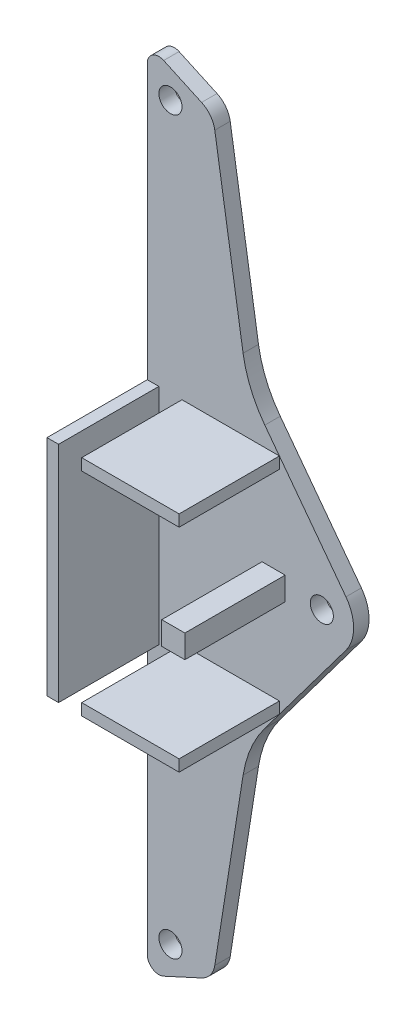
from build123d import *

# Parameters (mm, degrees)
SKETCH1_R           = 1.5
BOSS_EXTRUDE1_DEPTH = 2
FILLET1_R           = 15
FILLET2_R           = 3
FILLET3_R           = 1.5
FILLET4_R           = 5
SKETCH2_W           = 1.5
SKETCH2_H           = 3
SKETCH2_W_2         = 0.75
BOSS_EXTRUDE2_DEPTH = 13
SKETCH4_W           = 3
SKETCH4_H           = 29
CUT_EXTRUDE1_DEPTH  = 13


with BuildPart() as part:
    # Sketch1 → Boss-Extrude1 (new body)
    with BuildSketch(Plane.XY):
        Polygon((0, 52.37615434), (0, -52.37615434), (8.5, -48.47615434), (13, -20), (28, 0), (13, 20), (8.5, 48.47615434), align=None)
        with Locations((3, -47.37615434)):
            Circle(SKETCH1_R, mode=Mode.SUBTRACT)
        with Locations((22.62384566, 0)):
            Circle(SKETCH1_R, mode=Mode.SUBTRACT)
        with Locations(Location((3, 47.37615434, 0), (0, 0, 180))):
            Circle(SKETCH1_R, mode=Mode.SUBTRACT)
    extrude(amount=BOSS_EXTRUDE1_DEPTH)

    # Fillet1
    fillet1_edges = [part.edges().sort_by_distance(p)[0] for p in [
        (13, 20, 1),
        (13, -20, 1),
    ]]
    fillet(fillet1_edges, radius=FILLET1_R)

    # Fillet2
    fillet2_edges = [part.edges().sort_by_distance(p)[0] for p in [
        (8.5, 48.47615434, 1),
        (8.5, -48.47615434, 1),
    ]]
    fillet(fillet2_edges, radius=FILLET2_R)

    # Fillet3
    fillet3_edges = [part.edges().sort_by_distance(p)[0] for p in [
        (0, -52.37615434, 1),
        (0, 52.37615434, 1),
    ]]
    fillet(fillet3_edges, radius=FILLET3_R)

    # Fillet4
    fillet4_edges = [part.edges().sort_by_distance(p)[0] for p in [
        (28, 0, 1),
    ]]
    fillet(fillet4_edges, radius=FILLET4_R)

    # Sketch2 → Boss-Extrude2 (add)
    with BuildSketch(Plane.XY.offset(2)):
        Polygon((17.125, 13), (17.125, 14.5), (0, 14.5), (0, -14.5), (17.125, -14.5), (17.125, -13), (15.625, -13), (1.5, -13), (1.5, 13), (15.625, 13), align=None)
        with Locations((16.375, 0)):
            Rectangle(SKETCH2_W, SKETCH2_H)
        with Locations((17.5, 0)):
            Rectangle(SKETCH2_W_2, SKETCH2_H)
        with Locations((15.25, 0)):
            Rectangle(SKETCH2_W_2, SKETCH2_H)
    extrude(amount=BOSS_EXTRUDE2_DEPTH)

    # Sketch4 → Cut-Extrude1 (cut)
    with BuildSketch(Plane.XY.offset(15)):
        with Locations((3, 0)):
            Rectangle(SKETCH4_W, SKETCH4_H)
    extrude(amount=-CUT_EXTRUDE1_DEPTH, mode=Mode.SUBTRACT)


solid = part.part
